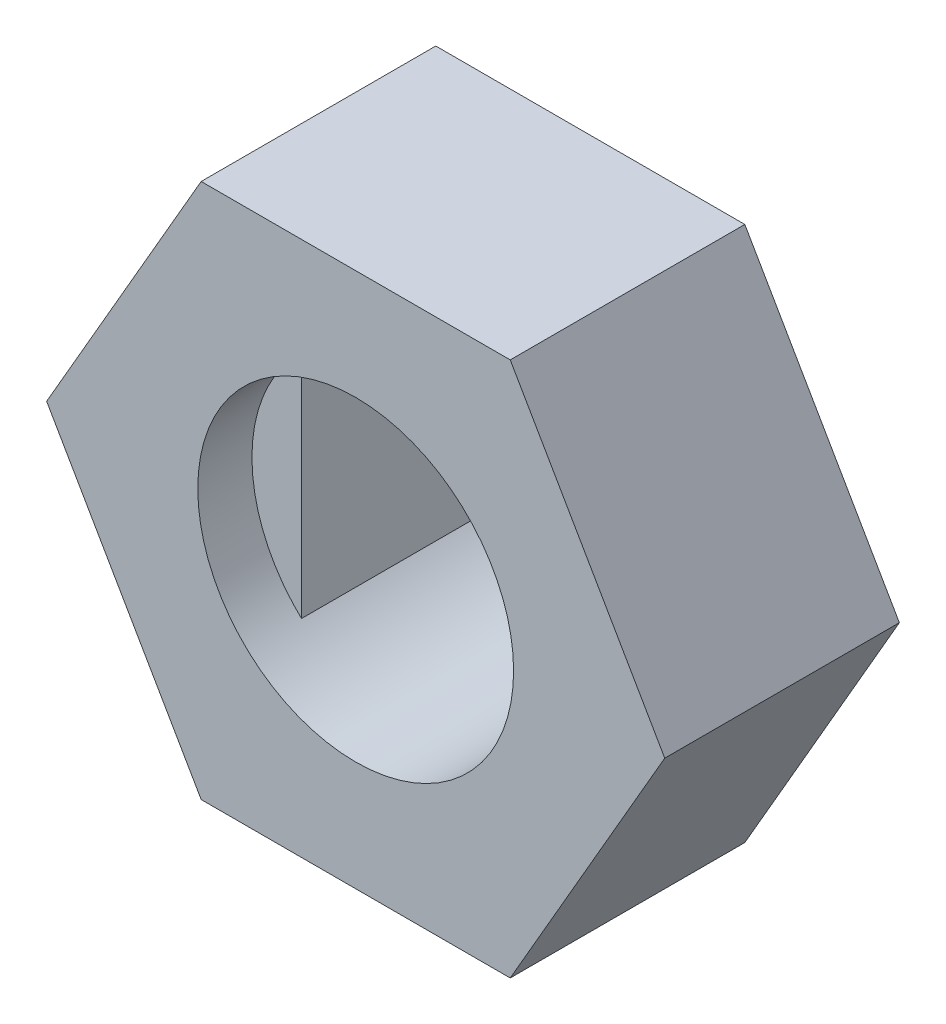
from build123d import *

# Parameters (mm, degrees)
SKETCH1_R             = 3.5
BOSS_EXTRUDE1_DEPTH   = 5.2
BOSS_EXTRUDE2_DEPTH   = 4
BOSS_EXTRUDE2_2_DEPTH = 4


with BuildPart() as part:
    # Sketch1 → Boss-Extrude1 (new body)
    with BuildSketch(Plane.XY):
        Polygon((6.85, 0), (3.425, 5.932274016), (-3.425, 5.932274016), (-6.85, 0), (-3.425, -5.932274016), (3.425, -5.932274016), align=None)
        Circle(SKETCH1_R, mode=Mode.SUBTRACT)
    extrude(amount=BOSS_EXTRUDE1_DEPTH)


with BuildPart() as body_2:
    # Sketch2 → Boss-Extrude2 (new body)
    with BuildSketch(Plane(origin=(0, 0, 0), x_dir=(-1, 0, 0), z_dir=(0, 0, -1))):
        with BuildLine():
            Line((2.4, 2.547547841), (2.4, -2.547547841))
            ThreePointArc((2.4, -2.547547841), (3.5, 0), (2.4, 2.547547841))
        make_face()
    extrude(amount=-BOSS_EXTRUDE2_DEPTH)


with BuildPart() as body_3:
    # Sketch2 → Boss-Extrude2 2 (new body)
    with BuildSketch(Plane(origin=(0, 0, 0), x_dir=(-1, 0, 0), z_dir=(0, 0, -1))):
        with BuildLine():
            Line((-2.4, 2.547547841), (-2.4, -2.547547841))
            ThreePointArc((-2.4, -2.547547841), (-3.5, 0), (-2.4, 2.547547841))
        make_face()
    extrude(amount=-BOSS_EXTRUDE2_2_DEPTH)


solid = Compound([part.part, body_2.part, body_3.part])
